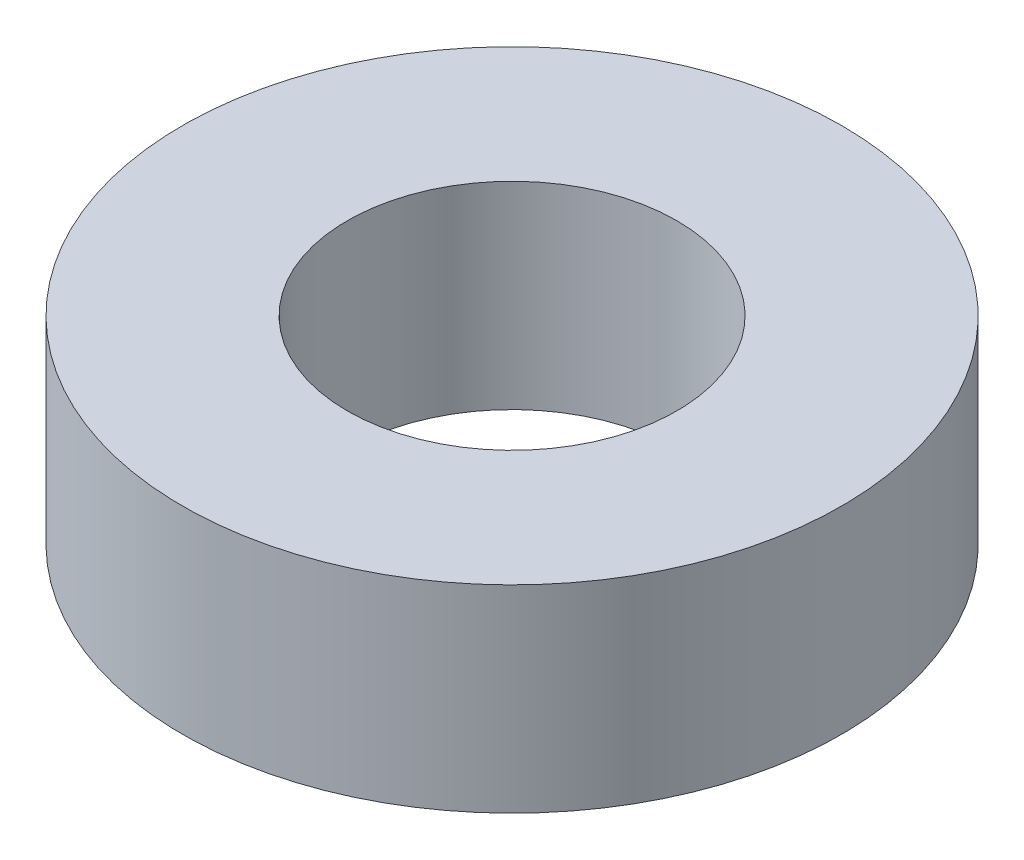
from build123d import *

# Parameters (mm, degrees)
SKETCH1_R           = 6.35
SKETCH1_R_2         = 3.175
BOSS_EXTRUDE1_DEPTH = 3.81


with BuildPart() as part:
    # Sketch1 → Boss-Extrude1 (new body)
    with BuildSketch(Plane(origin=(0, 0, 0), x_dir=(1, 0, 0), z_dir=(0, 1, 0))):
        with Locations(Location((0, 0, 0), (0, 0, 90))):
            Circle(SKETCH1_R)
        with Locations(Location((0, 0, 0), (0, 0, 90))):
            Circle(SKETCH1_R_2, mode=Mode.SUBTRACT)
    extrude(amount=BOSS_EXTRUDE1_DEPTH)


solid = part.part
